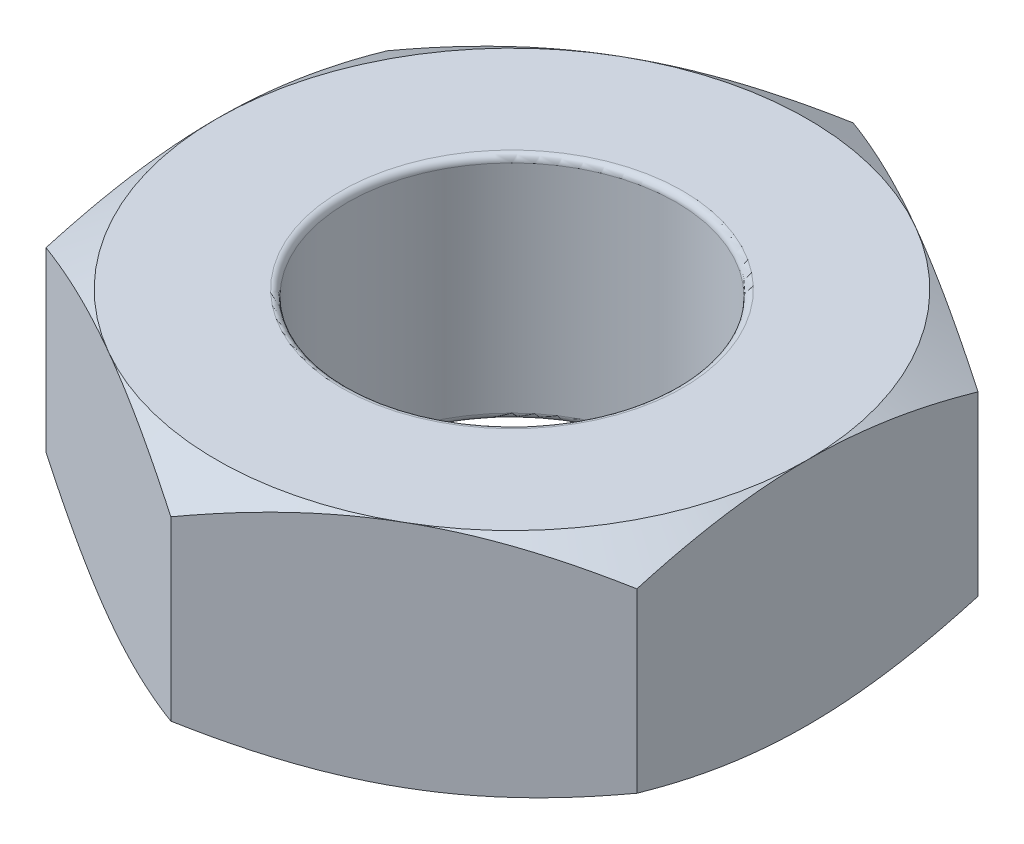
from build123d import *

# Parameters (mm, degrees)
SKETCH1_R           = 1.25
BOSS_EXTRUDE1_DEPTH = 1.75
SKETCH2_OUTSIDE_W   = 14.846
SKETCH2_OUTSIDE_H   = 15.542
SKETCH2_OUTSIDE_R   = 2.25
CUT_EXTRUDE1_DEPTH  = 2
CUT_EXTRUDE1_DRAFT  = -60
SKETCH3_OUTSIDE_W   = 14.846
SKETCH3_OUTSIDE_H   = 15.542
SKETCH3_OUTSIDE_R   = 2.25
CUT_EXTRUDE2_DEPTH  = 2
CUT_EXTRUDE2_DRAFT  = -60
FILLET1_R           = 0.05


with BuildPart() as part:
    # Sketch1 → Boss-Extrude1 (new body)
    with BuildSketch(Plane(origin=(0, 0, 0), x_dir=(1, 0, 0), z_dir=(0, 1, 0))):
        Polygon((0, 2.598076211), (-2.25, 1.299038106), (-2.25, -1.299038106), (0, -2.598076211), (2.25, -1.299038106), (2.25, 1.299038106), align=None)
        with Locations(Location((0, 0, 0), (0, 0, 270))):
            Circle(SKETCH1_R, mode=Mode.SUBTRACT)
    extrude(amount=BOSS_EXTRUDE1_DEPTH)


with BuildPart() as cut_extrude1_tool:
    # Sketch2 outside → Cut-Extrude1 (with draft: the straight prism first)
    with BuildSketch(Plane(origin=(0, 1.75, 0), x_dir=(1, 0, 0), z_dir=(0, 1, 0))):
        Rectangle(SKETCH2_OUTSIDE_W, SKETCH2_OUTSIDE_H)
        Circle(SKETCH2_OUTSIDE_R, mode=Mode.SUBTRACT)
    extrude(amount=-CUT_EXTRUDE1_DEPTH)
    # Cut-Extrude1: the draft: its side faces are tilted about the plane it starts from
    cut_extrude1_sides = [cut_extrude1_tool.faces().sort_by_distance(p)[0] for p in [
        (0, 0.75, 7.771),
        (7.423, 0.75, 0),
        (0, 0.75, -7.771),
        (-7.423, 0.75, 0),
        (-2.25, 0.75, 0),
    ]]
    draft(cut_extrude1_sides, Plane(origin=(0, 1.75, 0), x_dir=(1, 0, 0), z_dir=(0, 1, 0)), CUT_EXTRUDE1_DRAFT)


with BuildPart() as part_1:
    add(part.part)

    # Cut-Extrude1: cut by cut_extrude1_tool
    add(cut_extrude1_tool.part, mode=Mode.SUBTRACT)


with BuildPart() as cut_extrude2_tool:
    # Sketch3 outside → Cut-Extrude2 (with draft: the straight prism first)
    with BuildSketch(Plane.XZ):
        Rectangle(SKETCH3_OUTSIDE_W, SKETCH3_OUTSIDE_H)
        Circle(SKETCH3_OUTSIDE_R, mode=Mode.SUBTRACT)
    extrude(amount=-CUT_EXTRUDE2_DEPTH)
    # Cut-Extrude2: the draft: its side faces are tilted about the plane it starts from
    cut_extrude2_sides = [cut_extrude2_tool.faces().sort_by_distance(p)[0] for p in [
        (0, 1, -7.771),
        (7.423, 1, 0),
        (0, 1, 7.771),
        (-7.423, 1, 0),
        (-2.25, 1, 0),
    ]]
    draft(cut_extrude2_sides, Plane.XZ, CUT_EXTRUDE2_DRAFT)


with BuildPart() as part_2:
    add(part_1.part)

    # Cut-Extrude2: cut by cut_extrude2_tool
    add(cut_extrude2_tool.part, mode=Mode.SUBTRACT)

    # Fillet1
    fillet1_edges = [part_2.edges().sort_by_distance(p)[0] for p in [
        (0, 0, -1.25),
        (0, 1.75, -1.25),
    ]]
    fillet(fillet1_edges, radius=FILLET1_R)


solid = part_2.part
